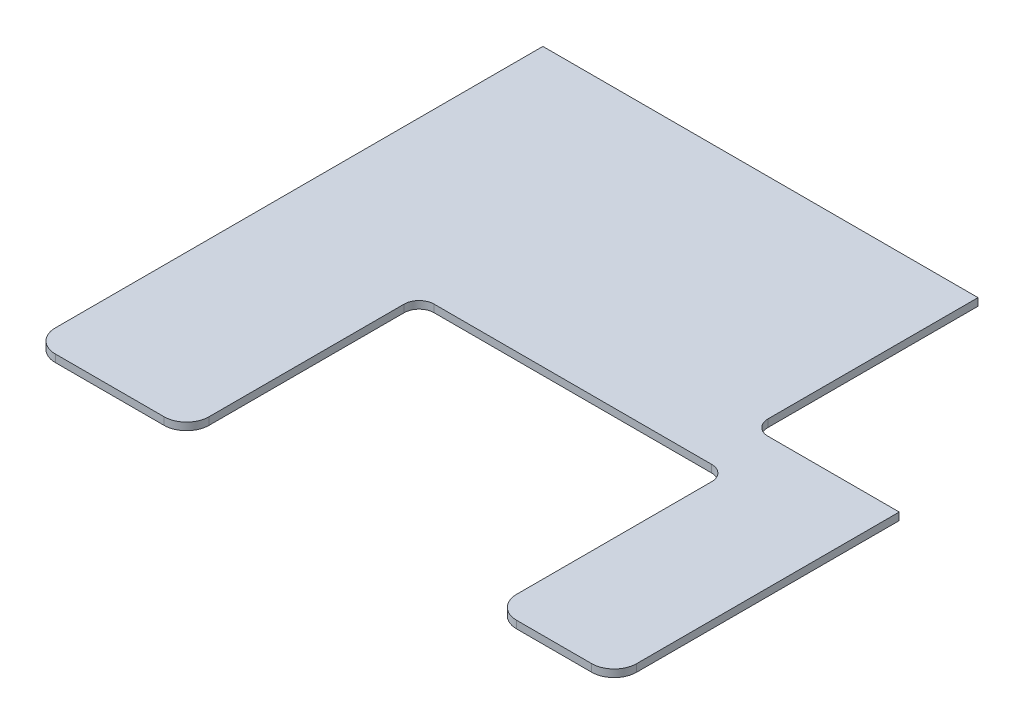
from build123d import *

# Parameters (mm, degrees)
ESBO_O1_W                = 775
ESBO_O1_H                = 680
RESSALTO_EXTRUS_O1_DEPTH = 10
CORTE_EXTRUS_O1_DEPTH    = 516.612499848
FILETE1_R                = 30


with BuildPart() as part:
    # Esboço1 → Ressalto-extrusão1 (new body)
    with BuildSketch(Plane(origin=(0, 0, 0), x_dir=(1, 0, 0), z_dir=(0, 1, 0))):
        Rectangle(ESBO_O1_W, ESBO_O1_H)
    extrude(amount=RESSALTO_EXTRUS_O1_DEPTH)

    # Esboço2 → Corte-extrusão1 (cut, through all)
    with BuildSketch(Plane(origin=(0, 10, 0), x_dir=(1, 0, 0), z_dir=(0, 1, 0))):
        with BuildLine():
            Line((387.5, 340), (192.5, 340))
            Line((192.5, 340), (192.5, 60))
            ThreePointArc((192.5, 60), (198.357864376, 45.857864376), (212.5, 40))
            Line((212.5, 40), (387.5, 40))
            Line((387.5, 40), (387.5, 340))
        make_face()
        with BuildLine():
            Line((-182.5, -340), (227.5, -340))
            Line((227.5, -340), (227.5, -50))
            ThreePointArc((227.5, -50), (221.642135624, -35.857864376), (207.5, -30))
            Line((207.5, -30), (-162.5, -30))
            ThreePointArc((-162.5, -30), (-176.642135624, -35.857864376), (-182.5, -50))
            Line((-182.5, -50), (-182.5, -340))
        make_face()
    extrude(amount=-CORTE_EXTRUS_O1_DEPTH, mode=Mode.SUBTRACT)

    # Filete1
    filete1_edges = [part.edges().sort_by_distance(p)[0] for p in [
        (-182.5, 5, 340),
        (227.5, 5, 340),
        (387.5, 5, 340),
        (-387.5, 5, 340),
    ]]
    fillet(filete1_edges, radius=FILETE1_R)


solid = part.part
